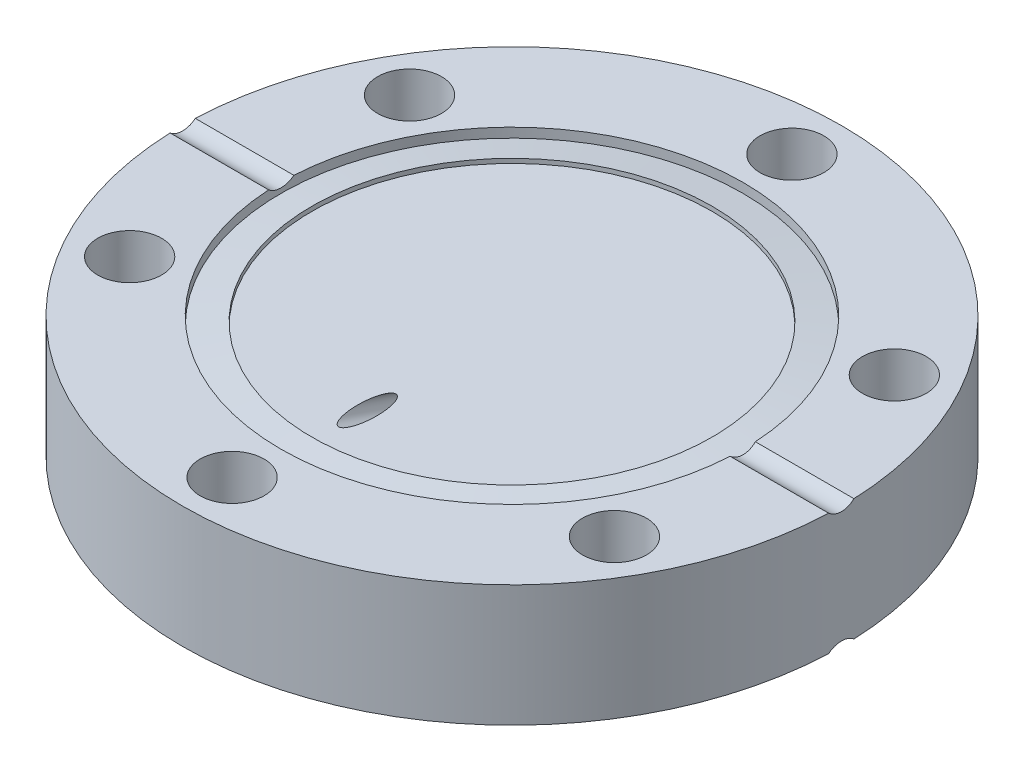
from build123d import *

# Parameters (mm, degrees)
SKETCH1_R               = 34.555
BOSS_EXTRUDE1_DEPTH     = 12.75
SKETCH2_R               = 3.35
CUT_EXTRUDE1_DEPTH      = 51.504044888
CIRPATTERN1_COUNT       = 6
SKETCH6_R               = 24.23
CUT_EXTRUDE3_DEPTH      = 1
CUT_EXTRUDE2_DEPTH      = 51.504044888
CUT_EXTRUDE2_DEPTH_BACK = 51.504044888
SKETCH4_R               = 2
CUT_EXTRUDE4_DEPTH      = 52.727217057
CUT_EXTRUDE4_DEPTH_BACK = 52.727217057
SKETCH9_R               = 1


with BuildPart() as part:
    # Sketch1 → Boss-Extrude1 (new body)
    with BuildSketch(Plane(origin=(0, 0, 0), x_dir=(1, 0, 0), z_dir=(0, 1, 0))):
        with Locations(Location((0, 0, 0), (0, 0, 270))):
            Circle(SKETCH1_R)
    extrude(amount=BOSS_EXTRUDE1_DEPTH)

    # Sketch2 → Cut-Extrude1 (cut, through all)
    with BuildSketch(Plane(origin=(0, 12.75, 0), x_dir=(1, 0, 0), z_dir=(0, 1, 0))):
        with Locations(Location((0, 29.35, 0), (0, 0, 270))):
            Circle(SKETCH2_R)
    cut_extrude1 = extrude(amount=-CUT_EXTRUDE1_DEPTH, mode=Mode.SUBTRACT)

    # CirPattern1: Cut-Extrude1 ×6 about axis
    cirpattern1_axis = Axis((0, 0, 0), (0, 1, 0))
    for i in range(1, CIRPATTERN1_COUNT):
        add(cut_extrude1.rotate(cirpattern1_axis, i * 360 / CIRPATTERN1_COUNT), mode=Mode.SUBTRACT)

    # Sketch6 → Cut-Extrude3 (cut)
    with BuildSketch(Plane.XZ):
        with Locations(Location((0, 0, 0), (0, 0, 270))):
            Circle(SKETCH6_R)
    cut_extrude3 = extrude(amount=-CUT_EXTRUDE3_DEPTH, mode=Mode.SUBTRACT)

    # Sketch7 → Revolve1 (revolve)
    with BuildSketch(Plane(origin=(0, 0, 0), x_dir=(0, 0, -1), z_dir=(1, 0, 0))):
        Polygon((24.23, 1), (20.98, 0.5334), (20.98, 1), align=None)
    revolve1 = revolve(axis=Axis((0, 0, 0), (0, 1, 0)))

    # Mirror1: Cut-Extrude3 across plane
    add(cut_extrude3.mirror(Plane(origin=(0, 6.375, 0), x_dir=(0, 0, 1), z_dir=(0, -1, 0))), mode=Mode.SUBTRACT)

    # Mirror2: Revolve1 across plane
    add(revolve1.mirror(Plane(origin=(0, 6.375, 0), x_dir=(0, 0, 1), z_dir=(0, -1, 0))))

    # Sketch4 → Cut-Extrude2 (cut, two sides: drawn at the far end of the back side and taken through both)
    with BuildSketch(Plane(origin=(0, 0, 0), x_dir=(0, 0, -1), z_dir=(1, 0, 0)).offset(-CUT_EXTRUDE2_DEPTH_BACK)):
        with Locations((0, 14.25)):
            Circle(SKETCH4_R)
        with Locations((0, -1.5)):
            Circle(SKETCH4_R)
    extrude(amount=CUT_EXTRUDE2_DEPTH + CUT_EXTRUDE2_DEPTH_BACK, mode=Mode.SUBTRACT)

    # Sketch9 → Cut-Extrude4 (cut, two sides: drawn at the far end of the back side and taken through both)
    with BuildSketch(Plane(origin=(0, 0.710347248, 2.005958746), x_dir=(1, 0, 0), z_dir=(0, 0.33380685923377496, 0.942641491092177)).offset(-CUT_EXTRUDE4_DEPTH_BACK)):
        with Locations(Location((0, 6.009339506, 0), (0, 0, 270))):
            Circle(SKETCH9_R)
    extrude(amount=CUT_EXTRUDE4_DEPTH + CUT_EXTRUDE4_DEPTH_BACK, mode=Mode.SUBTRACT)


solid = part.part
